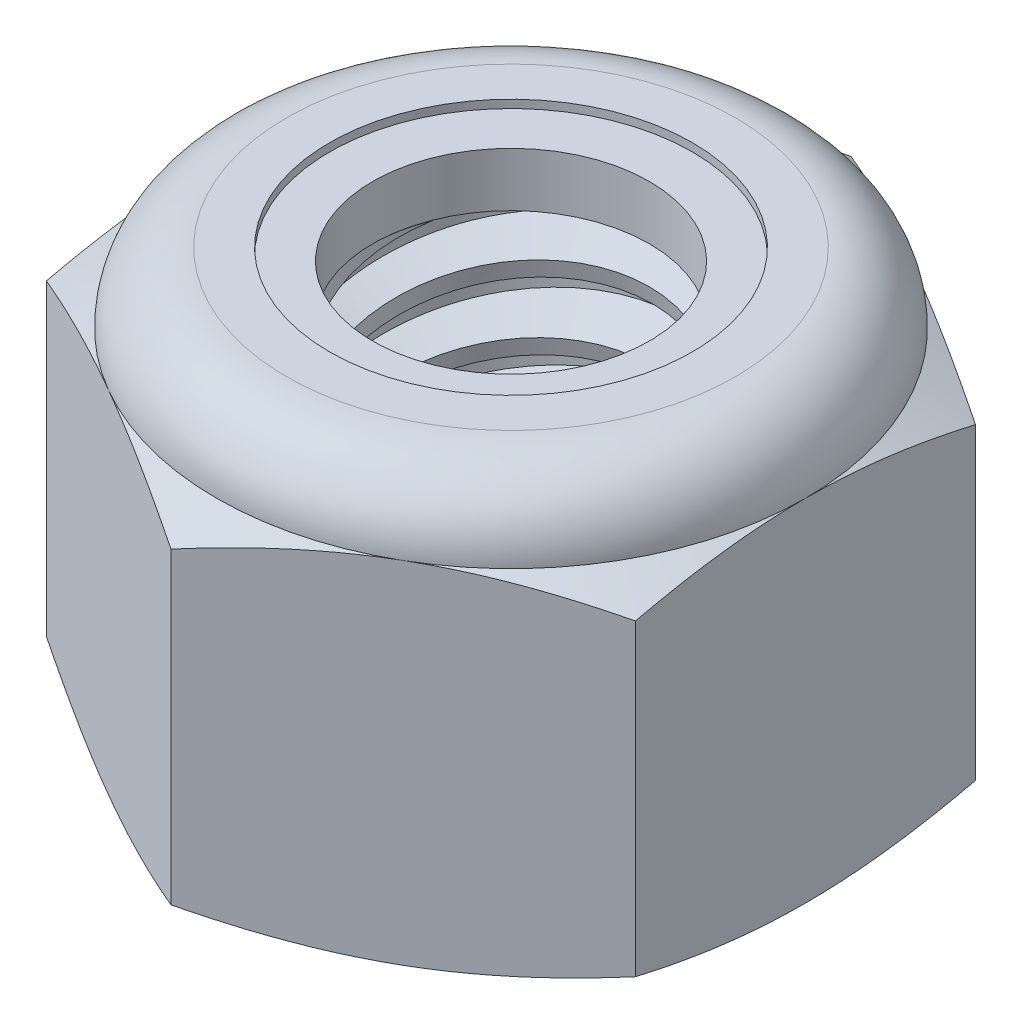
from build123d import *

# Parameters (mm, degrees)
EXTRUDE1_DEPTH      = 7.9375
SKETCH2_W           = 3.175
SKETCH2_H           = 7.9375
LPATTERN1_COUNT     = 6
LPATTERN1_PITCH     = 1.27
LPATTERN1_COL_COUNT = 2
LPATTERN1_COL_PITCH = 1.27


with BuildPart() as part:
    # Sketch1 → Extrude1 (new body)
    with BuildSketch(Plane(origin=(0, 0, 0), x_dir=(1, 0, 0), z_dir=(0, 1, 0))):
        Polygon((0, 6.415804866), (-5.55625, 3.207902433), (-5.55625, -3.207902433), (0, -6.415804866), (5.55625, -3.207902433), (5.55625, 3.207902433), align=None)
    extrude(amount=EXTRUDE1_DEPTH)

    # Sketch4 → Cut-Revolve2 (revolve, cut)
    with BuildSketch(Plane(origin=(0, 0, 0), x_dir=(0, 0, -1), z_dir=(1, 0, 0)), mode=Mode.PRIVATE) as cut_revolve2_sk:
        Polygon((0, 7.9375), (3.175, 7.9375), (2.609908356, 7.673993439), (2.609908356, 0.263506561), (3.175, 0), (0, 0), align=None)
    revolve(cut_revolve2_sk.sketch.rotate(Axis((0, 7.9375, 0), (0, 1, 0)), 54.49881281), axis=Axis((0, 7.9375, 0), (0, 1, 0)), mode=Mode.SUBTRACT)


with BuildPart() as body_2:
    # Sketch2 → Revolve1 (revolve)
    with BuildSketch(Plane(origin=(0, 0, 0), x_dir=(0, 0, -1), z_dir=(1, 0, 0))):
        with Locations((1.5875, 3.96875)):
            Rectangle(SKETCH2_W, SKETCH2_H)
    revolve(axis=Axis((0, -3.175, 0), (0, 1, 0)))

    # Sketch3 → Cut-Revolve1 (revolve, cut)
    with BuildSketch(Plane(origin=(0, 0, 0), x_dir=(0, 0, -1), z_dir=(1, 0, 0)), mode=Mode.PRIVATE) as cut_revolve1_sk:
        Polygon((3.206133436, 7.781832818), (3.424067492, 6.692162542), (2.672175229, 6.946518763), (2.609908356, 7.257853128), align=None)
    cut_revolve1 = revolve(cut_revolve1_sk.sketch.rotate(Axis((0, 7.9375, 0.272704483), (0, -0.9805806756909201, -0.19611613513818424)), 180), axis=Axis((0, 7.9375, 0.272704483), (0, -0.9805806756909201, -0.19611613513818424)), mode=Mode.SUBTRACT)

    # LPattern1: Cut-Revolve1 ×6
    with Locations(*[(0, -i * LPATTERN1_PITCH, 0) for i in range(1, LPATTERN1_COUNT)]):
        add(cut_revolve1, mode=Mode.SUBTRACT)

    # LPattern1 col: Cut-Revolve1 ×2
    with Locations(*[(0, i * LPATTERN1_COL_PITCH, 0) for i in range(1, LPATTERN1_COL_COUNT)]):
        add(cut_revolve1, mode=Mode.SUBTRACT)


with BuildPart() as part_1:
    add(part.part)

    # Combine1: cut body 2
    add(body_2.part, mode=Mode.SUBTRACT)

    # Sketch5 → Cut-Revolve3 (revolve, cut)
    with BuildSketch(Plane(origin=(0, 0, 0), x_dir=(0, 0, -1), z_dir=(1, 0, 0)), mode=Mode.PRIVATE) as cut_revolve3_sk:
        with BuildLine():
            Line((0, 0), (5.55625, 0))
            Line((5.55625, 0), (6.415804866, 0.400817017))
            Line((6.415804866, 0.400817017), (6.415804866, 6.213766317))
            Line((6.415804866, 6.213766317), (5.55625, 6.614583333))
            ThreePointArc((5.55625, 6.614583333), (5.168776679, 7.550026679), (4.233333333, 7.9375))
            Line((4.233333333, 7.9375), (4.233333333, 9.2075))
            Line((4.233333333, 9.2075), (7.685804866, 9.2075))
            Line((7.685804866, 9.2075), (7.685804866, -1.27))
            Line((7.685804866, -1.27), (0, -1.27))
            Line((0, -1.27), (0, 0))
        make_face()
    revolve(cut_revolve3_sk.sketch.rotate(Axis((0, 0, 0), (0, 1, 0)), 54.619043446), axis=Axis((0, 0, 0), (0, 1, 0)), mode=Mode.SUBTRACT)

    # Sketch6 → Cut-Revolve4 (revolve, cut)
    with BuildSketch(Plane(origin=(0, 0, 0), x_dir=(0, 0, -1), z_dir=(1, 0, 0)), mode=Mode.PRIVATE) as cut_revolve4_sk:
        with BuildLine():
            Line((0, 6.614583333), (5.40385, 6.614583333))
            ThreePointArc((5.40385, 6.614583333), (5.061013606, 7.442263606), (4.233333333, 7.7851))
            Line((4.233333333, 7.7851), (3.421620845, 7.7851))
            Line((3.421620845, 7.7851), (3.421620845, 9.2075))
            Line((3.421620845, 9.2075), (0, 9.2075))
            Line((0, 9.2075), (0, 6.614583333))
        make_face()
    revolve(cut_revolve4_sk.sketch.rotate(Axis((0, 9.2075, 0), (0, 1, 0)), 54.49881281), axis=Axis((0, 9.2075, 0), (0, 1, 0)), mode=Mode.SUBTRACT)


with BuildPart() as body_2_2:
    # Sketch7 → Revolve2 (revolve)
    with BuildSketch(Plane(origin=(0, 0, 0), x_dir=(0, 0, -1), z_dir=(1, 0, 0))):
        with BuildLine():
            Line((2.609908356, 6.690783333), (5.324993778, 6.690783333))
            ThreePointArc((5.324993778, 6.690783333), (4.979705237, 7.4148695), (4.233333333, 7.7089))
            Line((4.233333333, 7.7089), (2.609908356, 7.7089))
            Line((2.609908356, 7.7089), (2.609908356, 6.690783333))
        make_face()
    revolve(axis=Axis((0, 6.690783333, 0), (0, 1, 0)))


solid = Compound([part_1.part, body_2_2.part])
